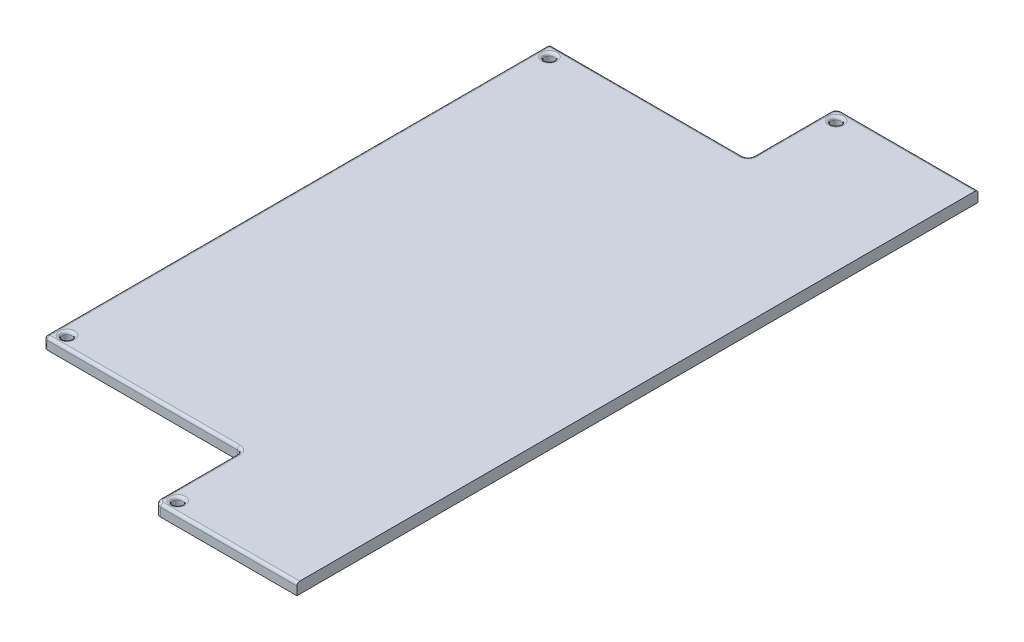
from build123d import *

# Parameters (mm, degrees)
SKETCH1_R           = 1.7
BOSS_EXTRUDE1_DEPTH = 4
FILLET1_R           = 2
FILLET2_R           = 1


with BuildPart() as part:
    # Sketch1 → Boss-Extrude1 (new body)
    with BuildSketch(Plane(origin=(0, 0, 0), x_dir=(1, 0, 0), z_dir=(0, 1, 0))):
        Polygon((0, 0), (0, 120), (-50, 120), (-50, 89), (-120, 89), (-120, 0), (-120, -89), (-50, -89), (-50, -120), (0, -120), align=None)
        with Locations(Location((-46, -116, 0), (0, 0, 270))):
            Circle(SKETCH1_R, mode=Mode.SUBTRACT)
        with Locations(Location((-116, -85, 0), (0, 0, 270))):
            Circle(SKETCH1_R, mode=Mode.SUBTRACT)
        with Locations(Location((-116, 85, 0), (0, 0, 270))):
            Circle(SKETCH1_R, mode=Mode.SUBTRACT)
        with Locations(Location((-46, 116, 0), (0, 0, 270))):
            Circle(SKETCH1_R, mode=Mode.SUBTRACT)
    extrude(amount=BOSS_EXTRUDE1_DEPTH)

    # Fillet1
    fillet1_edges = [part.edges().sort_by_distance(p)[0] for p in [
        (-50, 2, 120),
        (-50, 2, 89),
        (-50, 2, -89),
        (-50, 2, -120),
    ]]
    fillet(fillet1_edges, radius=FILLET1_R)

    # Fillet2
    fillet2_edges = [part.edges().sort_by_distance(p)[0] for p in [
        (-24, 4, -120),
        (-120, 2, 89),
        (-120, 2, -89),
        (-120, 4, 0),
        (-46, 4, 114.3),
        (-116, 4, 83.3),
        (-86, 4, 89),
        (-116, 4, -86.7),
        (-46, 4, -117.7),
        (-86, 4, -89),
        (-50, 4, -104.5),
        (-50, 4, 104.5),
        (-24, 4, 120),
        (-49.414213562, 4, 119.414213562),
        (-49.414213562, 4, -119.414213562),
        (-50.585786438, 4, -89.585786438),
        (-50.585786438, 4, 89.585786438),
    ]]
    fillet(fillet2_edges, radius=FILLET2_R)


solid = part.part
